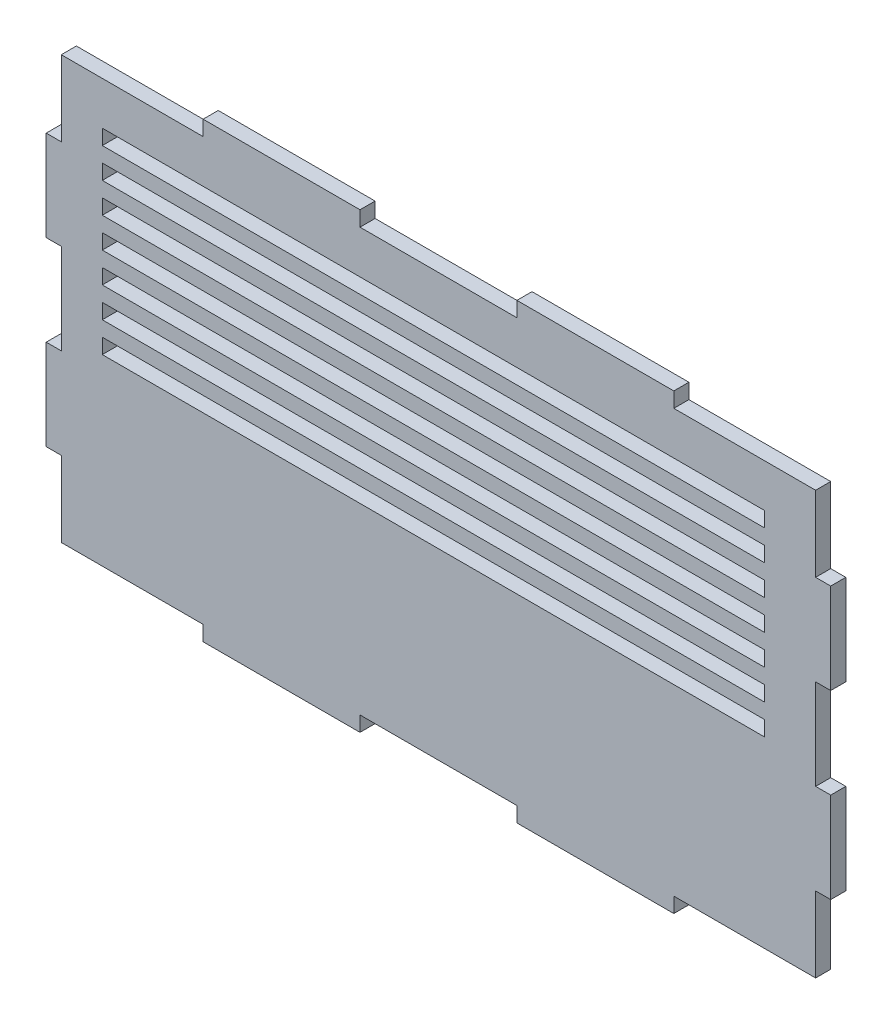
from build123d import *

# Parameters (mm, degrees)
CROQUIS1_W              = 219.410669775
CROQUIS1_H              = 5
SALIENTE_EXTRUIR1_DEPTH = 5


with BuildPart() as part:
    # Croquis1 → Saliente-Extruir1 (new body)
    with BuildSketch(Plane.XY):
        Polygon((52, 0), (104, 0), (104, 5), (156, 5), (156, 0), (208, 0), (208, 5), (255, 5), (255, 30), (260, 30), (260, 60), (255, 60), (255, 90), (260, 90), (260, 120), (255, 120), (255, 145), (208, 145), (208, 150), (156, 150), (156, 145), (104, 145), (104, 150), (52, 150), (52, 145), (5, 145), (5, 120), (0, 120), (0, 90), (5, 90), (5, 60), (0, 60), (0, 30), (5, 30), (5, 5), (52, 5), align=None)
        with Locations((128.287883766, 128.217905572)):
            Rectangle(CROQUIS1_W, CROQUIS1_H, mode=Mode.SUBTRACT)
        with Locations((128.287883766, 118.217905572)):
            Rectangle(CROQUIS1_W, CROQUIS1_H, mode=Mode.SUBTRACT)
        with Locations((128.287883766, 108.217905572)):
            Rectangle(CROQUIS1_W, CROQUIS1_H, mode=Mode.SUBTRACT)
        with Locations((128.287883766, 98.217905572)):
            Rectangle(CROQUIS1_W, CROQUIS1_H, mode=Mode.SUBTRACT)
        with Locations((128.287883766, 88.217905572)):
            Rectangle(CROQUIS1_W, CROQUIS1_H, mode=Mode.SUBTRACT)
        with Locations((128.287883766, 78.217905572)):
            Rectangle(CROQUIS1_W, CROQUIS1_H, mode=Mode.SUBTRACT)
        with Locations((128.287883766, 68.217905572)):
            Rectangle(CROQUIS1_W, CROQUIS1_H, mode=Mode.SUBTRACT)
    extrude(amount=SALIENTE_EXTRUIR1_DEPTH)


solid = part.part
